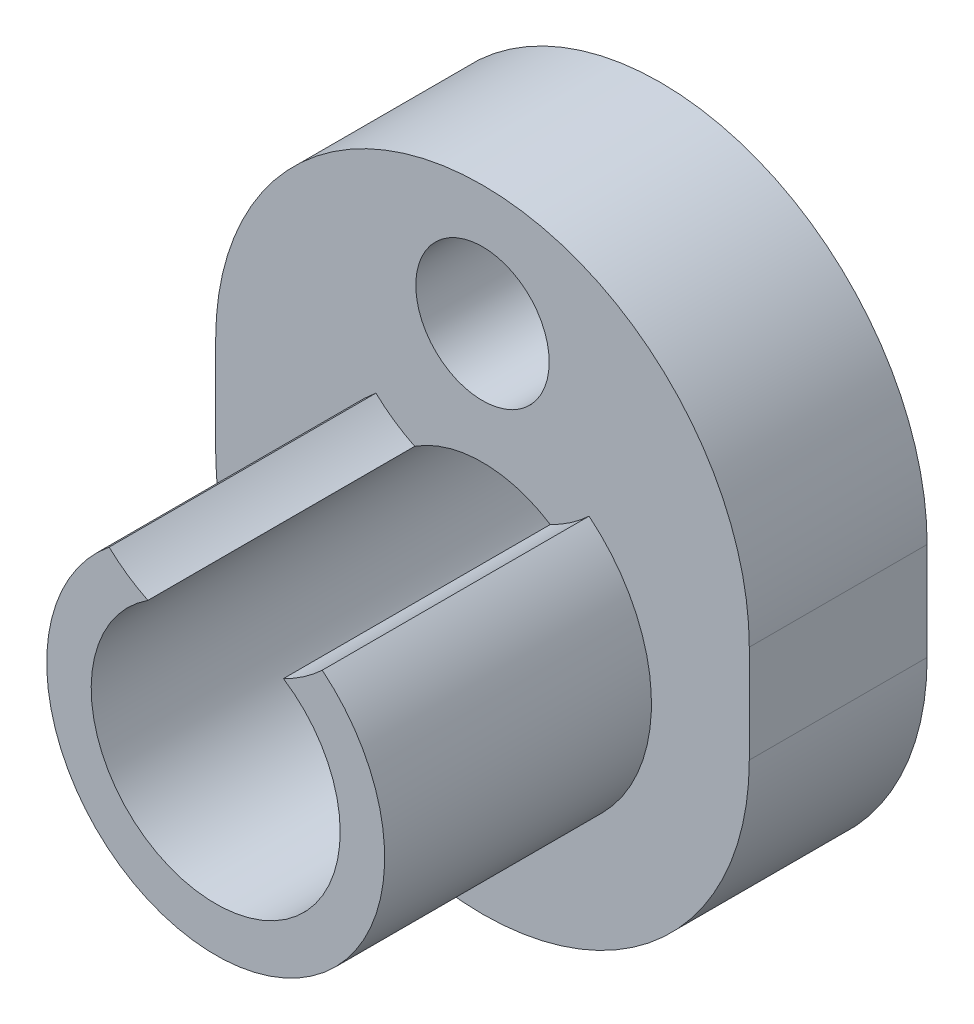
from build123d import *

# Parameters (mm, degrees)
SKETCH1_R           = 2.8
SKETCH1_R_2         = 1.5
BOSS_EXTRUDE3_DEPTH = 4
BOSS_EXTRUDE5_DEPTH = 10


with BuildPart() as part:
    # Sketch1 → Boss-Extrude3 (new body)
    with BuildSketch(Plane.XY):
        with BuildLine():
            ThreePointArc((-5.977999231, 19.918015055), (0.022000769, 13.918015055), (6.022000769, 19.918015055))
            Line((6.022000769, 19.918015055), (6.022000769, 22.118015055))
            ThreePointArc((6.022000769, 22.118015055), (0.022000769, 28.118015055), (-5.977999231, 22.118015055))
            Line((-5.977999231, 22.118015055), (-5.977999231, 19.918015055))
        make_face()
        with Locations((0.022000769, 19.918015055)):
            Circle(SKETCH1_R, mode=Mode.SUBTRACT)
        with Locations((0.022000769, 25.418015055)):
            Circle(SKETCH1_R_2, mode=Mode.SUBTRACT)
    extrude(amount=BOSS_EXTRUDE3_DEPTH)

    # Sketch1<8> → Boss-Extrude5 (add)
    with BuildSketch(Plane.XY):
        with BuildLine():
            ThreePointArc((-2.374426324, 22.867105964), (0.022000769, 16.118015055), (2.418427861, 22.867105964))
            ThreePointArc((2.418427861, 22.867105964), (2.004907724, 22.533906873), (1.545736934, 22.267105964))
            ThreePointArc((1.545736934, 22.267105964), (0.022000769, 17.118015055), (-1.501735396, 22.267105964))
            ThreePointArc((-1.501735396, 22.267105964), (-1.960906186, 22.533906873), (-2.374426324, 22.867105964))
        make_face()
    extrude(amount=BOSS_EXTRUDE5_DEPTH)


solid = part.part
